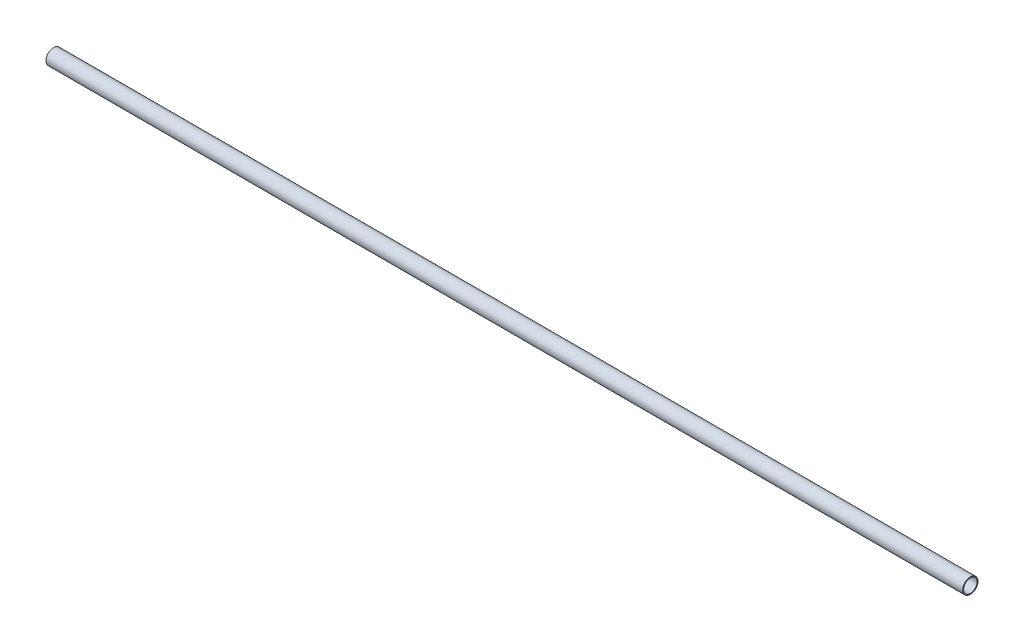
from build123d import *

# Parameters (mm, degrees)
SKETCH1_R           = 12.5
SKETCH1_R_2         = 11
BOSS_EXTRUDE1_DEPTH = 1500


with BuildPart() as part:
    # Sketch1 → Boss-Extrude1 (new body)
    with BuildSketch(Plane(origin=(0, 0, 0), x_dir=(0, 0, -1), z_dir=(1, 0, 0))):
        Circle(SKETCH1_R)
        Circle(SKETCH1_R_2, mode=Mode.SUBTRACT)
    extrude(amount=BOSS_EXTRUDE1_DEPTH)


solid = part.part
